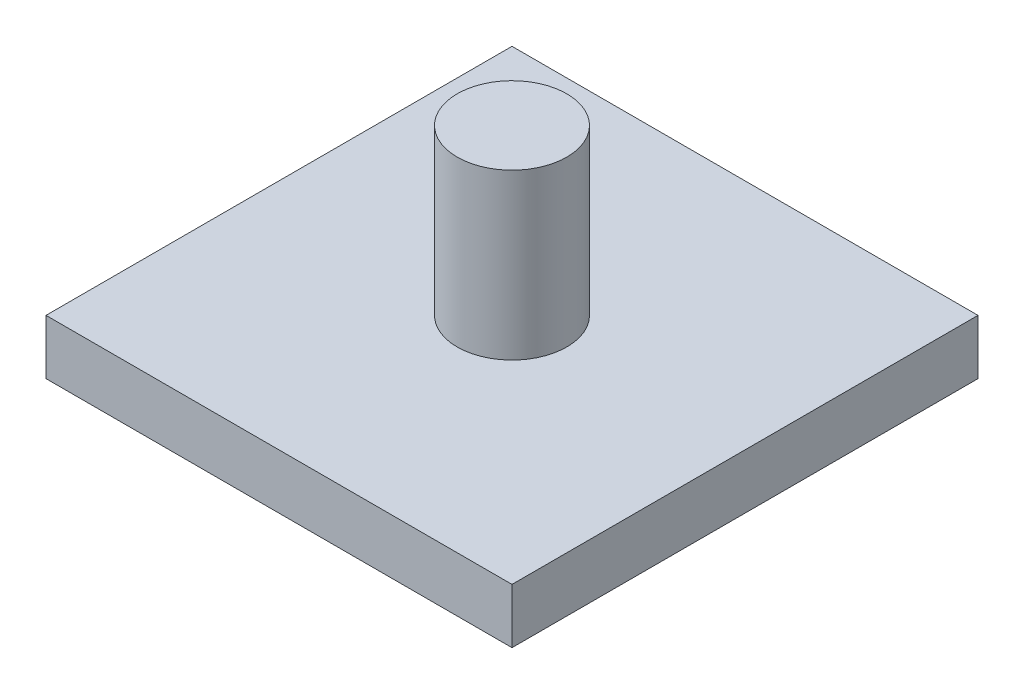
from build123d import *

# Parameters (mm, degrees)
SKETCH2_W           = 17
SKETCH2_H           = 17
BOSS_EXTRUDE1_DEPTH = 2
SKETCH3_R           = 2
BOSS_EXTRUDE2_DEPTH = 6


with BuildPart() as part:
    # Sketch2 → Boss-Extrude1 (new body)
    with BuildSketch(Plane(origin=(0, 0, 0), x_dir=(1, 0, 0), z_dir=(0, 1, 0))):
        with Locations((2.54505814, -0.901889535)):
            Rectangle(SKETCH2_W, SKETCH2_H)
    extrude(amount=BOSS_EXTRUDE1_DEPTH)

    # Sketch3 → Boss-Extrude2 (add)
    with BuildSketch(Plane(origin=(0, 2, 0), x_dir=(1, 0, 0), z_dir=(0, 1, 0))):
        with Locations(Location((2.54505814, -0.901889535, 0), (0, 0, 270))):
            Circle(SKETCH3_R)
    extrude(amount=BOSS_EXTRUDE2_DEPTH)


solid = part.part
